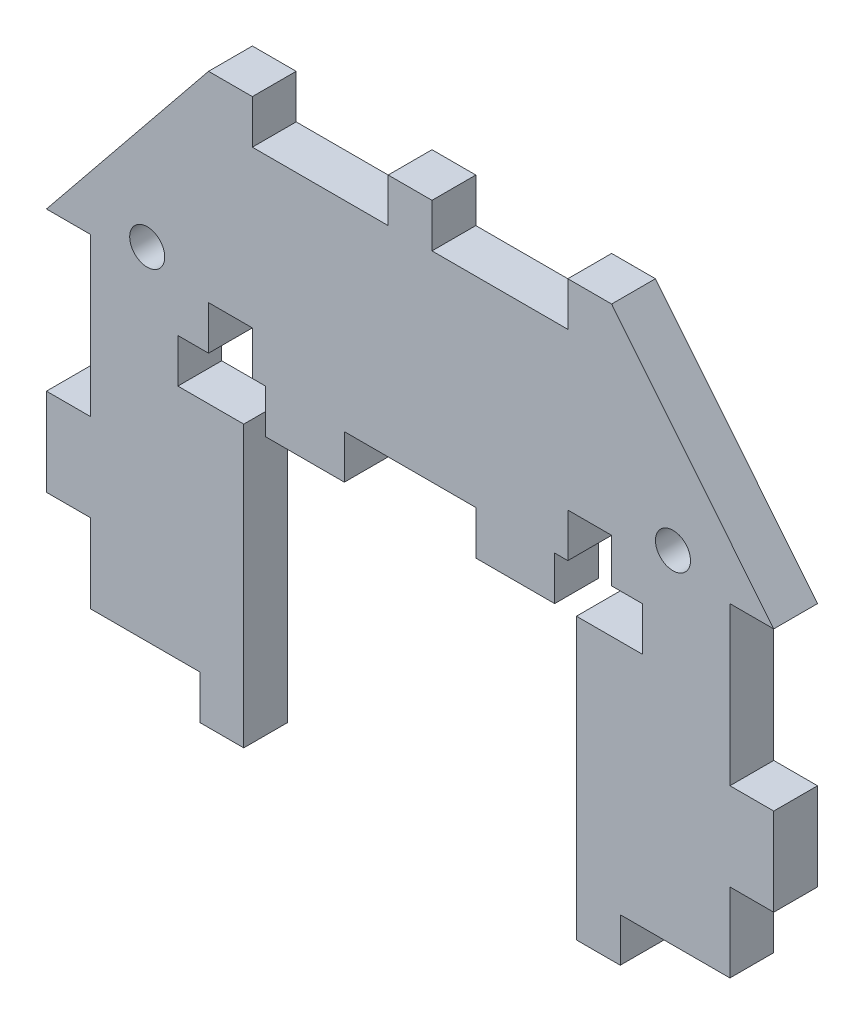
from build123d import *

# Parameters (mm, degrees)
BOSS_EXTRU_1_DEPTH         = 5
ESQUISSE2_W                = 5
ESQUISSE2_H                = 18
ESQUISSE2_W_2              = 10
ESQUISSE2_H_2              = 5
ESQUISSE2_W_3              = 15
ESQUISSE2_W_4              = 15.5
ENL_V_MAT_EXTRU_1_DEPTH    = 5
ESQUISSE3_W                = 5
ESQUISSE3_H                = 5
ENL_V_MAT_EXTRU_2_DEPTH    = 5
TROUS_DE_CENTRAGE_4_0MM4_D = 4
TROUS_DE_CENTRAGE_4_0MM5_D = 4
TROUS_DE_CENTRAGE_4_0MM6_D = 4


with BuildPart() as part:
    # Esquisse1 → Boss.-Extru.1 (new body)
    with BuildSketch(Plane.XY):
        Polygon((-23, 0), (-41.5, -22.86), (-41.5, -64.86), (-18.983337354, -64.86), (-18.983337354, -32.86), (18.983337354, -32.86), (18.983337354, -64.86), (41.5, -64.86), (41.5, -22.86), (23, 0), align=None)
    extrude(amount=BOSS_EXTRU_1_DEPTH)

    # Esquisse2 → Enlèv. mat.-Extru.1 (cut)
    with BuildSketch(Plane.XY.offset(5)):
        with Locations((39, -31.86)):
            Rectangle(ESQUISSE2_W, ESQUISSE2_H)
        Polygon((23.983337354, -64.86), (41.5, -64.86), (41.5, -50.86), (36.5, -50.86), (36.5, -59.86), (23.983337354, -59.86), align=None)
        Polygon((-41.5, -64.86), (-41.5, -50.86), (-36.5, -50.86), (-36.5, -59.86), (-23.983337354, -59.86), (-23.983337354, -64.86), align=None)
        with Locations((-39, -31.86)):
            Rectangle(ESQUISSE2_W, ESQUISSE2_H)
        with Locations((-21.5, -30.36)):
            Rectangle(ESQUISSE2_W_2, ESQUISSE2_H_2)
        with Locations((0, -30.36)):
            Rectangle(ESQUISSE2_W_3, ESQUISSE2_H_2)
        with Locations((-10.25, -2.5)):
            Rectangle(ESQUISSE2_W_4, ESQUISSE2_H_2)
        with Locations((21.5, -30.36)):
            Rectangle(ESQUISSE2_W_2, ESQUISSE2_H_2)
        with Locations((10.25, -2.5)):
            Rectangle(ESQUISSE2_W_4, ESQUISSE2_H_2)
    extrude(amount=-ENL_V_MAT_EXTRU_1_DEPTH, mode=Mode.SUBTRACT)

    # Esquisse3 → Enlèv. mat.-Extru.2 (cut)
    with BuildSketch(Plane.XY.offset(5)):
        with Locations((20.5, -25.36)):
            Rectangle(ESQUISSE3_W, ESQUISSE3_H)
        with Locations((-20.5, -25.36)):
            Rectangle(ESQUISSE3_W, ESQUISSE3_H)
    extrude(amount=-ENL_V_MAT_EXTRU_2_DEPTH, mode=Mode.SUBTRACT)

    # Trous de centrage Ø4.0mm4 (through all)
    with Locations(Plane(origin=(42.887612711, 88.220426897, -73), x_dir=(0.8660254037844433, -0.49999999999999195, 0), z_dir=(0, 0, -1))):
        with Locations((65.70121345, -88.022614393), (117.662737677, -58.022614393), (-109.080426897, -72.887612711), (-109.080426897, -12.887612711), (-8.58231078, 130.910227103), (43.379213447, 100.910227103)):
            Hole(TROUS_DE_CENTRAGE_4_0MM4_D / 2)

    # Trous de centrage Ø4.0mm5 (through all)
    with Locations(Plane(origin=(42.887612711, 88.220426897, -73), x_dir=(0, 1, 0), z_dir=(0, 0, -1))):
        with Locations((65.70121345, -88.022614393), (117.662737677, -58.022614393), (-109.080426897, -72.887612711), (-109.080426897, -12.887612711), (-8.58231078, 130.910227103), (43.379213447, 100.910227103)):
            Hole(TROUS_DE_CENTRAGE_4_0MM5_D / 2)

    # Trous de centrage Ø4.0mm6 (through all)
    with Locations(Plane(origin=(42.887612711, 88.220426897, -73), x_dir=(-0.8660254037844363, -0.500000000000004, -1.3467405774952851e-15), z_dir=(0, 0, -1))):
        with Locations((65.70121345, -88.022614393), (117.662737677, -58.022614393), (-109.080426897, -72.887612711), (-109.080426897, -12.887612711), (-8.58231078, 130.910227103), (43.379213447, 100.910227103)):
            Hole(TROUS_DE_CENTRAGE_4_0MM6_D / 2)


solid = part.part
